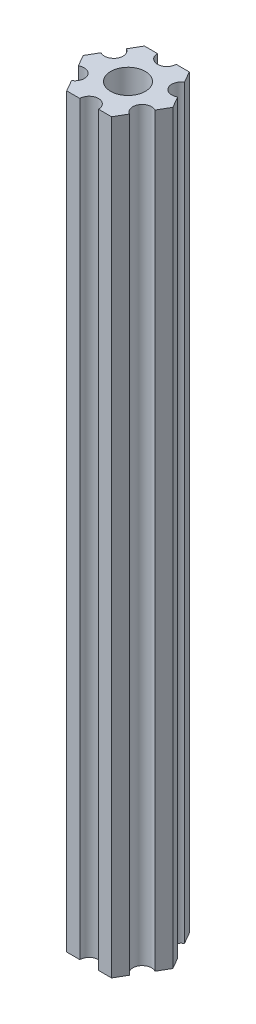
from build123d import *

# Parameters (mm, degrees)
ESBO_O1_R                = 2.79
RESSALTO_EXTRUS_O1_DEPTH = 120


with BuildPart() as part:
    # Esboço1 → Ressalto-extrusão1 (new body)
    with BuildSketch(Plane(origin=(0, 85, 0), x_dir=(1, 0, 0), z_dir=(0, 1, 0))):
        with BuildLine():
            Line((6.162658774, -1.825961894), (7.216878365, 0))
            Line((7.216878365, 0), (6.162658774, 1.825961894))
            ThreePointArc((6.162658774, 1.825961894), (4.113620668, 2.375), (4.662658774, 4.424038106))
            Line((4.662658774, 4.424038106), (3.608439182, 6.25))
            Line((3.608439182, 6.25), (1.5, 6.25))
            ThreePointArc((1.5, 6.25), (0, 4.75), (-1.5, 6.25))
            Line((-1.5, 6.25), (-3.608439182, 6.25))
            Line((-3.608439182, 6.25), (-4.662658774, 4.424038106))
            ThreePointArc((-4.662658774, 4.424038106), (-4.113620668, 2.375), (-6.162658774, 1.825961894))
            Line((-6.162658774, 1.825961894), (-7.216878365, 0))
            Line((-7.216878365, 0), (-6.162658774, -1.825961894))
            ThreePointArc((-6.162658774, -1.825961894), (-4.113620668, -2.375), (-4.662658774, -4.424038106))
            Line((-4.662658774, -4.424038106), (-3.608439182, -6.25))
            Line((-3.608439182, -6.25), (-1.5, -6.25))
            ThreePointArc((-1.5, -6.25), (0, -4.75), (1.5, -6.25))
            Line((1.5, -6.25), (3.608439182, -6.25))
            Line((3.608439182, -6.25), (4.662658774, -4.424038106))
            ThreePointArc((4.662658774, -4.424038106), (4.113620668, -2.375), (6.162658774, -1.825961894))
        make_face()
        with Locations(Location((0, 0, 0), (0, 0, 90))):
            Circle(ESBO_O1_R, mode=Mode.SUBTRACT)
    extrude(amount=-RESSALTO_EXTRUS_O1_DEPTH)


solid = part.part
